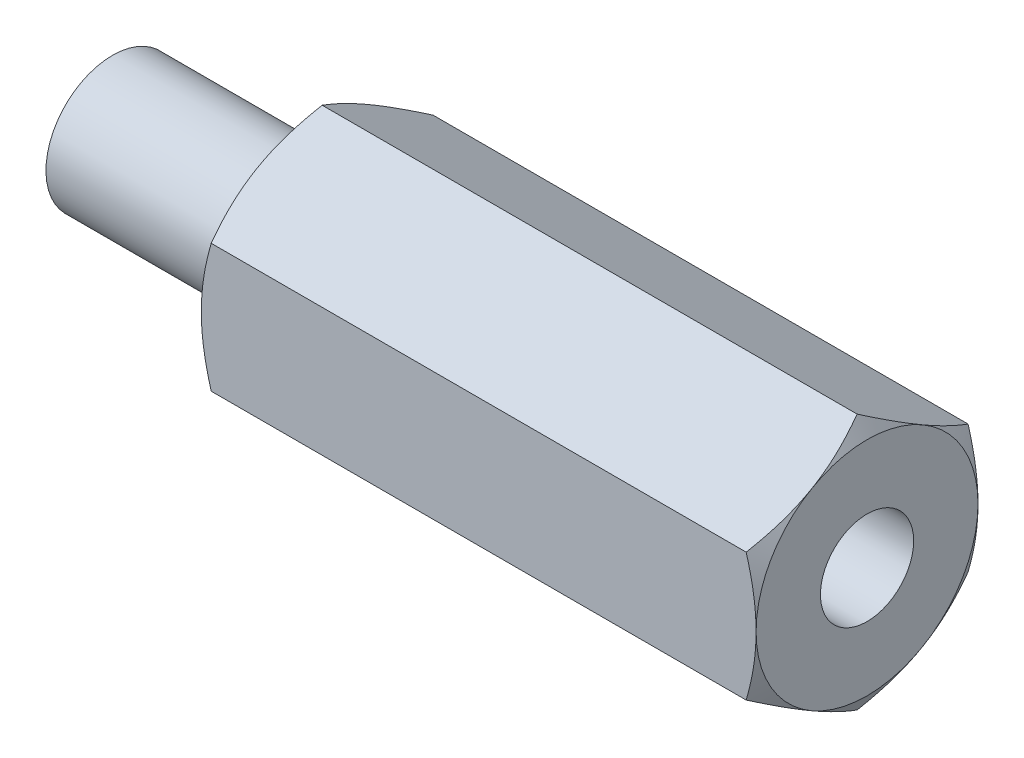
from build123d import *

# Parameters (mm, degrees)
BOSS_EXTRUDE1_DEPTH = 25
SKETCH3_W           = 9
SKETCH3_H           = 3
TAPPED_HOLE1_D      = 4.2
TAPPED_HOLE1_DEPTH  = 14
TAPPED_HOLE1_TIP    = 1.2618073
FILLET1_R           = 0.5


with BuildPart() as part:
    # Sketch1 → Boss-Extrude1 (new body)
    with BuildSketch(Plane(origin=(0, 0, 0), x_dir=(0, 0, -1), z_dir=(1, 0, 0))):
        Polygon((0, 5.773502692), (-5, 2.886751346), (-5, -2.886751346), (0, -5.773502692), (5, -2.886751346), (5, 2.886751346), align=None)
    extrude(amount=BOSS_EXTRUDE1_DEPTH)

    # Sketch2 → Cut-Revolve1 (revolve, cut)
    with BuildSketch(Plane.XY):
        Polygon((0.446581987, 5.773502692), (0, 5.773502692), (0, 5), align=None)
        Polygon((25, 5), (25, 5.773502692), (24.553418013, 5.773502692), align=None)
    revolve(axis=Axis((0, 0, 0), (1, 0, 0)), mode=Mode.SUBTRACT)

    # Sketch3 → Revolve1 (revolve)
    with BuildSketch(Plane.XY):
        with Locations((-4.5, 1.5)):
            Rectangle(SKETCH3_W, SKETCH3_H)
    revolve(axis=Axis((0, 0, 0), (-1, 0, 0)))

    # Tapped Hole1
    with Locations(Plane(origin=(25, 0, 0), x_dir=(0, 0, -1), z_dir=(1, 0, 0))):
        with Locations((0, 0)):
            Hole(TAPPED_HOLE1_D / 2, depth=TAPPED_HOLE1_DEPTH)
            with Locations((0, 0, -(TAPPED_HOLE1_DEPTH + TAPPED_HOLE1_TIP / 2))):  # 118° drill point
                Cone(0, TAPPED_HOLE1_D / 2, TAPPED_HOLE1_TIP, mode=Mode.SUBTRACT)

    # Fillet1
    fillet1_edges = [part.edges().sort_by_distance(p)[0] for p in [
        (0, -3, 0),
    ]]
    fillet(fillet1_edges, radius=FILLET1_R)


solid = part.part
